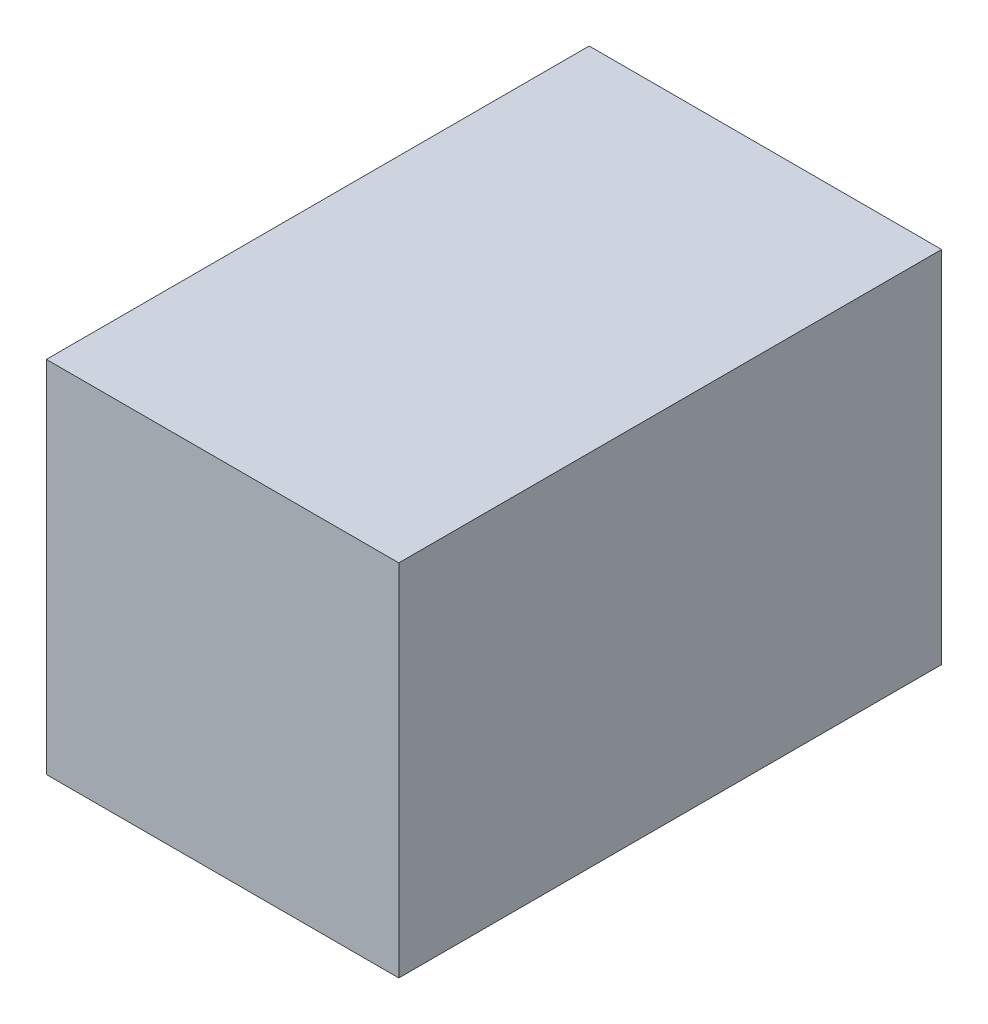
from build123d import *

# Parameters (mm, degrees)
SKETCH1_W           = 34.8
SKETCH1_H           = 35.5
BOSS_EXTRUDE1_DEPTH = 53.6


with BuildPart() as part:
    # Sketch1 → Boss-Extrude1 (new body)
    with BuildSketch(Plane.XY):
        with Locations((0, 15)):
            Rectangle(SKETCH1_W, SKETCH1_H)
    extrude(amount=-BOSS_EXTRUDE1_DEPTH)


solid = part.part
